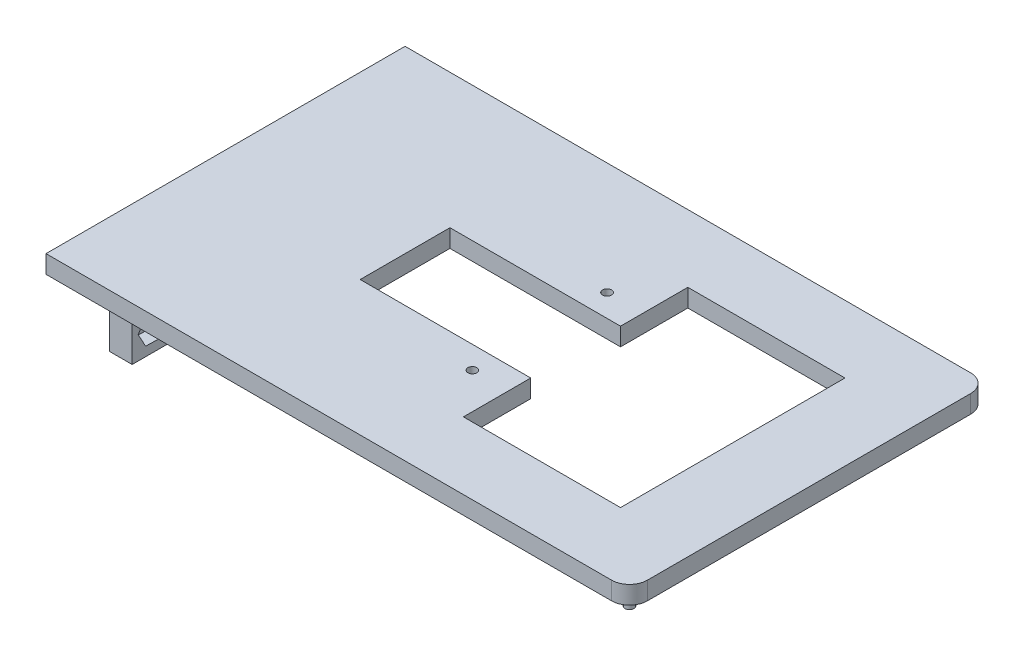
from build123d import *

# Parameters (mm, degrees)
BOSS_EXTRUDE1_DEPTH = 4
SKETCH2_R           = 1
BOSS_EXTRUDE2_DEPTH = 3.5
SKETCH3_W           = 5
SKETCH3_H           = 10
BOSS_EXTRUDE3_DEPTH = 10
SKETCH4_R           = 1.55
CUT_EXTRUDE1_DEPTH  = 3
SKETCH4_3_R         = 1.55
CUT_EXTRUDE2_DEPTH  = 5
SKETCH7_R           = 3
CUT_EXTRUDE3_DEPTH  = 2
SKETCH8_R           = 1
CUT_EXTRUDE4_DEPTH  = 2
SKETCH9_R           = 1
CUT_EXTRUDE5_DEPTH  = 2
CUT_EXTRUDE6_DEPTH  = 4
SKETCH6_R           = 1.55
CUT_EXTRUDE7_DEPTH  = 3
SKETCH6_3_R         = 1.55
CUT_EXTRUDE8_DEPTH  = 5


with BuildPart() as part:
    # Sketch1 → Boss-Extrude1 (new body)
    with BuildSketch(Plane(origin=(0, 0, 0), x_dir=(1, 0, 0), z_dir=(0, 1, 0))):
        with BuildLine():
            Line((0, 80), (0, 0))
            Line((0, 0), (126, 0))
            ThreePointArc((126, 0), (128.828427125, 1.171572875), (130, 4))
            Line((130, 4), (130, 76))
            ThreePointArc((130, 76), (128.828427125, 78.828427125), (126, 80))
            Line((126, 80), (0, 80))
        make_face()
    extrude(amount=BOSS_EXTRUDE1_DEPTH)

    # Sketch2 → Boss-Extrude2 (add)
    with BuildSketch(Plane(origin=(0, 0, 0), x_dir=(-1, 0, 0), z_dir=(0, -1, 0))):
        with Locations(Location((-125.5, 4.5, 0), (0, 0, 270))):
            Circle(SKETCH2_R)
        with Locations(Location((-125.5, 75.5, 0), (0, 0, 270))):
            Circle(SKETCH2_R)
    extrude(amount=BOSS_EXTRUDE2_DEPTH)

    # Sketch3 → Boss-Extrude3 (add)
    with BuildSketch(Plane(origin=(0, 0, 0), x_dir=(-1, 0, 0), z_dir=(0, -1, 0))):
        with Locations((-14.5, 7.2)):
            Rectangle(SKETCH3_W, SKETCH3_H)
        with Locations((-14.5, 72.8)):
            Rectangle(SKETCH3_W, SKETCH3_H)
    extrude(amount=BOSS_EXTRUDE3_DEPTH)

    # Sketch4 → Cut-Extrude1 (cut)
    with BuildSketch(Plane(origin=(17, 0, 0), x_dir=(0, 0, -1), z_dir=(1, 0, 0))):
        Polygon((3.535898385, -4.923428426), (5.201636264, -7.961714213), (8.665737879, -8.038285787), (10.464101615, -5.076571574), (8.798363736, -2.038285787), (5.334262121, -1.961714213), align=None)
        with Locations((7, -5)):
            Circle(SKETCH4_R, mode=Mode.SUBTRACT)
    extrude(amount=-CUT_EXTRUDE1_DEPTH, mode=Mode.SUBTRACT)

    # Sketch4<3> → Cut-Extrude2 (cut)
    with BuildSketch(Plane(origin=(17, 0, 0), x_dir=(0, 0, -1), z_dir=(1, 0, 0))):
        with Locations((7, -5)):
            Circle(SKETCH4_3_R)
    extrude(amount=-CUT_EXTRUDE2_DEPTH, mode=Mode.SUBTRACT)

    # Sketch7 → Cut-Extrude3 (cut)
    with BuildSketch(Plane.XZ):
        with Locations(Location((70, -25, 0), (0, 0, 270))):
            Circle(SKETCH7_R)
        with Locations(Location((70, -55, 0), (0, 0, 270))):
            Circle(SKETCH7_R)
    extrude(amount=-CUT_EXTRUDE3_DEPTH, mode=Mode.SUBTRACT)

    # Sketch8 → Cut-Extrude4 (cut)
    with BuildSketch(Plane(origin=(0, 2, 0), x_dir=(-1, 0, 0), z_dir=(0, -1, 0))):
        with Locations(Location((-70, 55, 0), (0, 0, 90))):
            Circle(SKETCH8_R)
    extrude(amount=-CUT_EXTRUDE4_DEPTH, mode=Mode.SUBTRACT)

    # Sketch9 → Cut-Extrude5 (cut)
    with BuildSketch(Plane(origin=(0, 2, 0), x_dir=(-1, 0, 0), z_dir=(0, -1, 0))):
        with Locations(Location((-70, 25, 0), (0, 0, 90))):
            Circle(SKETCH9_R)
    extrude(amount=-CUT_EXTRUDE5_DEPTH, mode=Mode.SUBTRACT)

    # Sketch10 → Cut-Extrude6 (cut)
    with BuildSketch(Plane(origin=(0, 0, 0), x_dir=(-1, 0, 0), z_dir=(0, -1, 0))):
        Polygon((-78, 30), (-40, 30), (-40, 50), (-78, 50), (-78, 65), (-113, 65), (-113, 15), (-78, 15), align=None)
    extrude(amount=-CUT_EXTRUDE6_DEPTH, mode=Mode.SUBTRACT)

    # Sketch6 → Cut-Extrude7 (cut)
    with BuildSketch(Plane(origin=(17, 0, 0), x_dir=(0, 0, -1), z_dir=(1, 0, 0))):
        Polygon((76.464101615, -5), (74.732050808, -2), (71.267949192, -2), (69.535898385, -5), (71.267949192, -8), (74.732050808, -8), align=None)
        with Locations((73, -5)):
            Circle(SKETCH6_R, mode=Mode.SUBTRACT)
    extrude(amount=-CUT_EXTRUDE7_DEPTH, mode=Mode.SUBTRACT)

    # Sketch6<3> → Cut-Extrude8 (cut)
    with BuildSketch(Plane(origin=(17, 0, 0), x_dir=(0, 0, -1), z_dir=(1, 0, 0))):
        with Locations((73, -5)):
            Circle(SKETCH6_3_R)
    extrude(amount=-CUT_EXTRUDE8_DEPTH, mode=Mode.SUBTRACT)


solid = part.part
